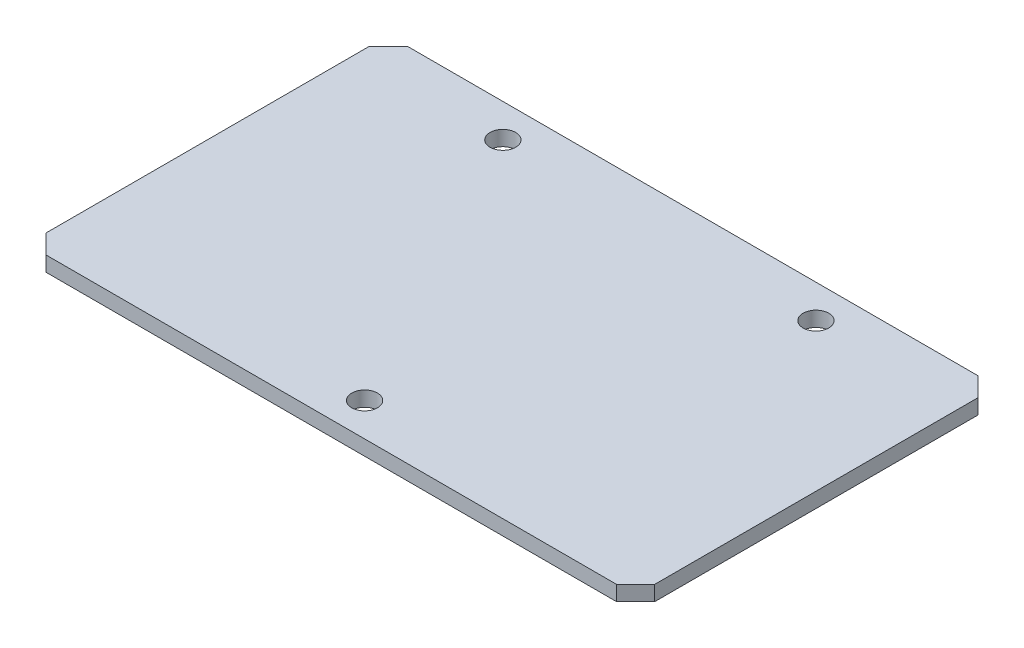
from build123d import *

# Parameters (mm, degrees)
SKETCH1_W           = 64
SKETCH1_H           = 38
BOSS_EXTRUDE1_DEPTH = 1.57875
CHAMFER1_SIZE       = 2
SKETCH3_R           = 1.35
CUT_EXTRUDE1_DEPTH  = 38.249059741


with BuildPart() as part:
    # Sketch1 → Boss-Extrude1 (new body)
    with BuildSketch(Plane(origin=(0, 0, 0), x_dir=(1, 0, 0), z_dir=(0, 1, 0))):
        Rectangle(SKETCH1_W, SKETCH1_H)
    extrude(amount=BOSS_EXTRUDE1_DEPTH)

    # Chamfer1
    chamfer1_edges = [part.edges().sort_by_distance(p)[0] for p in [
        (32, 0.789375, 19),
        (-32, 0.789375, 19),
        (-32, 0.789375, -19),
        (32, 0.789375, -19),
    ]]
    chamfer(chamfer1_edges, length=CHAMFER1_SIZE)

    # Sketch3 → Cut-Extrude1 (cut, through all)
    with BuildSketch(Plane(origin=(0, 1.57875, 0), x_dir=(1, 0, 0), z_dir=(0, 1, 0))):
        with Locations(Location((-16.46, 15.5, 0), (0, 0, 270))):
            Circle(SKETCH3_R)
        with Locations(Location((16.46, 15.5, 0), (0, 0, 270))):
            Circle(SKETCH3_R)
        with Locations(Location((0, -15.5, 0), (0, 0, 270))):
            Circle(SKETCH3_R)
    extrude(amount=-CUT_EXTRUDE1_DEPTH, mode=Mode.SUBTRACT)


solid = part.part
